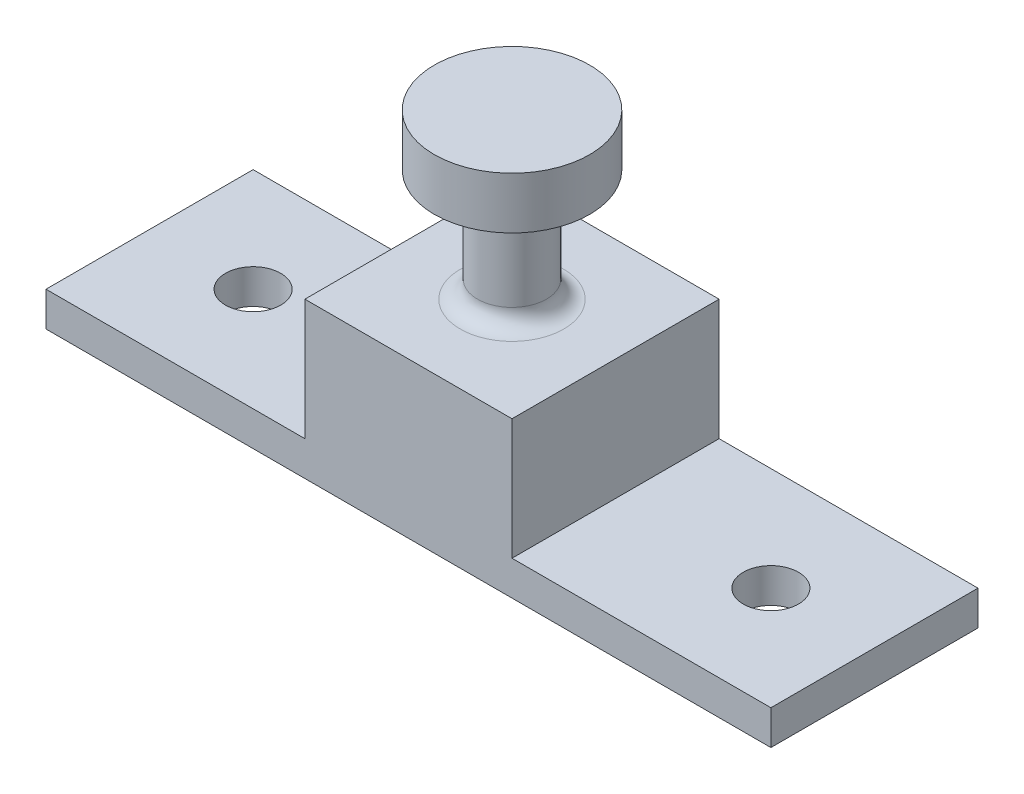
from build123d import *

# Parameters (mm, degrees)
CROQUIS1_W              = 42
CROQUIS1_H              = 12
CROQUIS1_R              = 1.6
SALIENTE_EXTRUIR1_DEPTH = 2
CROQUIS2_W              = 12
CROQUIS2_H              = 12
SALIENTE_EXTRUIR2_DEPTH = 7
CROQUIS3_R              = 2
SALIENTE_EXTRUIR3_DEPTH = 6.5
CROQUIS4_R              = 4.5
SALIENTE_EXTRUIR4_DEPTH = 3
REDONDEO1_R             = 1


with BuildPart() as part:
    # Croquis1 → Saliente-Extruir1 (new body)
    with BuildSketch(Plane(origin=(0, 0, 0), x_dir=(1, 0, 0), z_dir=(0, 1, 0))):
        Rectangle(CROQUIS1_W, CROQUIS1_H)
        with Locations(Location((-15, 0, 0), (0, 0, 270))):
            Circle(CROQUIS1_R, mode=Mode.SUBTRACT)
        with Locations(Location((15, 0, 0), (0, 0, 270))):
            Circle(CROQUIS1_R, mode=Mode.SUBTRACT)
    extrude(amount=SALIENTE_EXTRUIR1_DEPTH)

    # Croquis2 → Saliente-Extruir2 (add)
    with BuildSketch(Plane(origin=(0, 2, 0), x_dir=(1, 0, 0), z_dir=(0, 1, 0))):
        Rectangle(CROQUIS2_W, CROQUIS2_H)
    extrude(amount=SALIENTE_EXTRUIR2_DEPTH)

    # Croquis3 → Saliente-Extruir3 (add)
    with BuildSketch(Plane(origin=(0, 9, 0), x_dir=(1, 0, 0), z_dir=(0, 1, 0))):
        with Locations(Location((0, 0, 0), (0, 0, 90))):
            Circle(CROQUIS3_R)
    extrude(amount=SALIENTE_EXTRUIR3_DEPTH)

    # Croquis4 → Saliente-Extruir4 (add)
    with BuildSketch(Plane(origin=(0, 15.5, 0), x_dir=(1, 0, 0), z_dir=(0, 1, 0))):
        with Locations(Location((0, 0, 0), (0, 0, 270))):
            Circle(CROQUIS4_R)
    extrude(amount=SALIENTE_EXTRUIR4_DEPTH)

    # Redondeo1
    redondeo1_edges = [part.edges().sort_by_distance(p)[0] for p in [
        (0, 9, 2),
    ]]
    fillet(redondeo1_edges, radius=REDONDEO1_R)


solid = part.part
